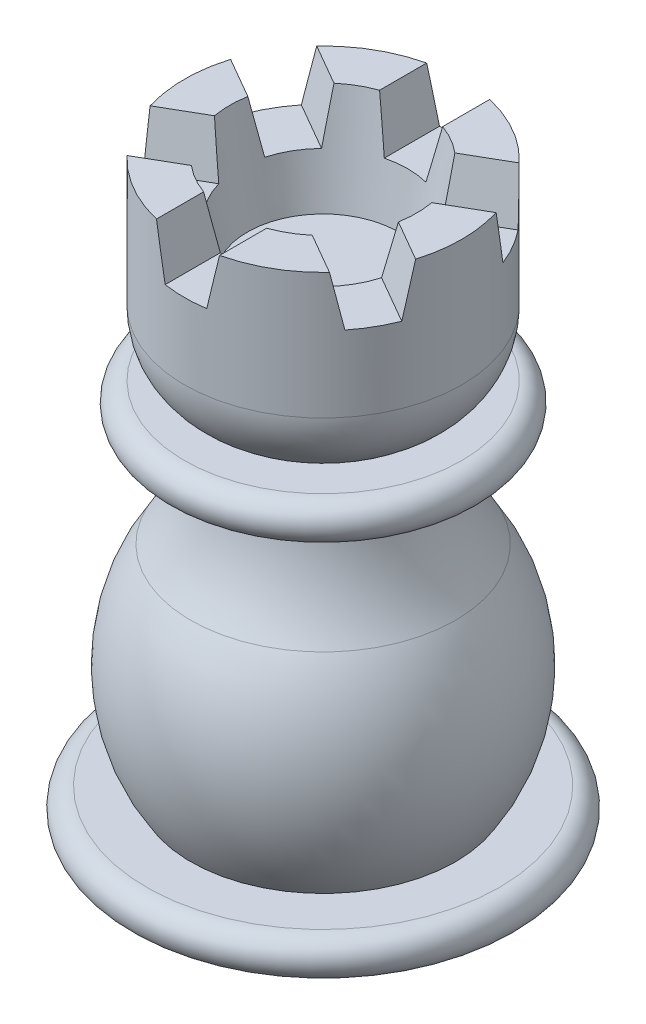
from build123d import *

# Parameters (mm, degrees)
SKETCH3_R          = 6
CUT_EXTRUDE1_DEPTH = 8
CUT_EXTRUDE2_DEPTH = 51.955863315
CIRPATTERN2_COUNT  = 3


with BuildPart() as part:
    # Sketch1 → Revolve1 (revolve)
    with BuildSketch(Plane.XY):
        with BuildLine():
            Line((0, 0), (14, 0))
            ThreePointArc((14, 0), (15.5, 1.5), (14, 3))
            Line((14, 3), (10.5, 3))
            ThreePointArc((10.5, 3), (13, 11.29163817), (10.499915764, 19.583250941))
            ThreePointArc((10.499915764, 19.583250941), (8.648748728, 23.510719191), (8, 27.803847577))
            Line((8, 27.803847577), (11, 27.803847577))
            ThreePointArc((11, 27.803847577), (12.5, 29.303847577), (11, 30.803847577))
            Line((11, 30.803847577), (8, 30.803847577))
            ThreePointArc((8, 30.803847577), (10.196152423, 33), (11, 36))
            Line((11, 36), (11, 46))
            Line((11, 46), (0, 46))
            Line((0, 46), (0, 0))
        make_face()
    revolve(axis=Axis((0, 0, 0), (0, 1, 0)))

    # Sketch3 → Cut-Extrude1 (cut)
    with BuildSketch(Plane(origin=(0, 46, 0), x_dir=(1, 0, 0), z_dir=(0, 1, 0))):
        with Locations(Location((0, 0, 0), (0, 0, 180))):
            Circle(SKETCH3_R)
    extrude(amount=-CUT_EXTRUDE1_DEPTH, mode=Mode.SUBTRACT)

    # Sketch4 → Cut-Revolve1 (revolve, cut)
    with BuildSketch(Plane.XY):
        Polygon((6, 38), (7.410615846, 46), (6, 46), align=None)
    revolve(axis=Axis((0, 49.650263766, 0), (0, -1, 0)), mode=Mode.SUBTRACT)

    # Sketch5 → Cut-Extrude2 (cut, symmetric)
    with BuildSketch(Plane.XY):
        Polygon((-2.5, 46), (-1.649773753, 42), (1.649773753, 42), (2.5, 46), align=None)
    cut_extrude2 = extrude(amount=CUT_EXTRUDE2_DEPTH, both=True, mode=Mode.SUBTRACT)

    # CirPattern2: Cut-Extrude2 ×3 about axis
    cirpattern2_axis = Axis((0, 0, 0), (0, 1, 0))
    for i in range(1, CIRPATTERN2_COUNT):
        add(cut_extrude2.rotate(cirpattern2_axis, i * 360 / CIRPATTERN2_COUNT), mode=Mode.SUBTRACT)


solid = part.part
